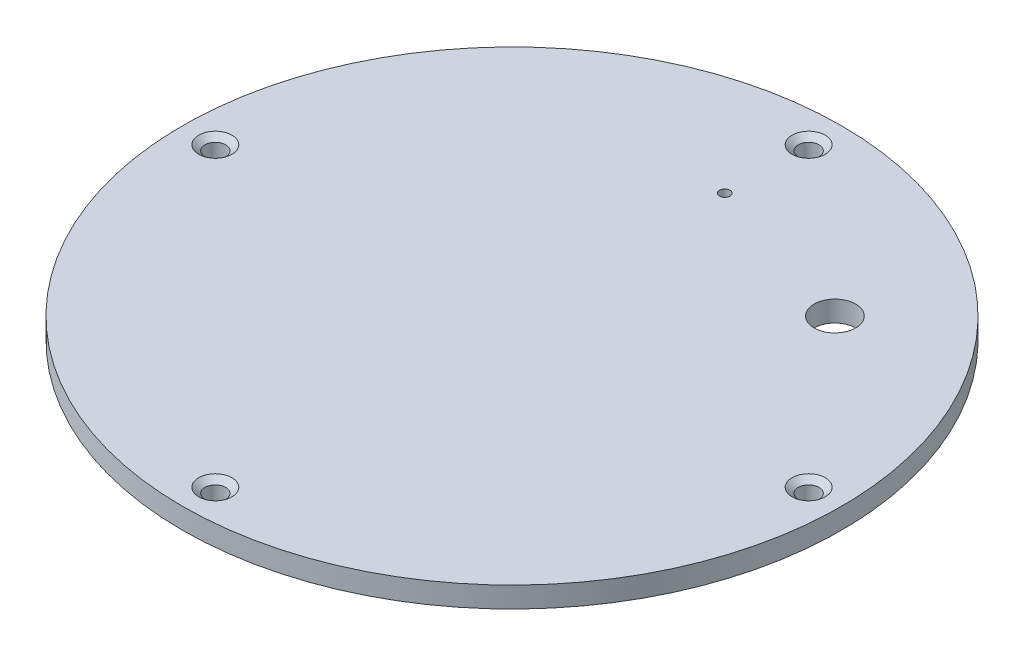
from build123d import *

# Parameters (mm, degrees)
SKETCH1_R                                       = 15.875
BOSS_EXTRUDE1_DEPTH                             = 1
CSK_FOR_M2_FLAT_HEAD_MACHINE_SCREW1_D           = 1
CSK_FOR_M2_FLAT_HEAD_MACHINE_SCREW1_CSINK_D     = 1.6
CSK_FOR_M2_FLAT_HEAD_MACHINE_SCREW1_CSINK_ANGLE = 100
CUT_EXTRUDE1_DEPTH                              = 23.472900347
CUT_EXTRUDE1_DEPTH_BACK                         = 23.472900347
SKETCH5_R                                       = 0.25
SKETCH5_R_2                                     = 1


with BuildPart() as part:
    # Sketch1 → Boss-Extrude1 (new body)
    with BuildSketch(Plane(origin=(0, 0, 0), x_dir=(1, 0, 0), z_dir=(0, 1, 0))):
        with Locations(Location((0, 0, 0), (0, 0, 270))):
            Circle(SKETCH1_R)
    extrude(amount=BOSS_EXTRUDE1_DEPTH)

    # CSK for M2 Flat Head Machine Screw1 (through all)
    with Locations(Plane(origin=(0, 1, 0), x_dir=(1, 0, 0), z_dir=(0, 1, 0))):
        with Locations((0, 14.29), (14.29, 0), (0, -14.29), (-14.29, 0)):
            CounterSinkHole(CSK_FOR_M2_FLAT_HEAD_MACHINE_SCREW1_D / 2, CSK_FOR_M2_FLAT_HEAD_MACHINE_SCREW1_CSINK_D / 2, counter_sink_angle=CSK_FOR_M2_FLAT_HEAD_MACHINE_SCREW1_CSINK_ANGLE)

    # Sketch5 → Cut-Extrude1 (cut, two sides: drawn at the far end of the back side and taken through both)
    with BuildSketch(Plane(origin=(0, 1, 0), x_dir=(1, 0, 0), z_dir=(0, 1, 0)).offset(-CUT_EXTRUDE1_DEPTH_BACK)):
        with Locations(Location((0, 10.25, 0), (0, 0, 270))):
            Circle(SKETCH5_R)
        with Locations(Location((7.778174593, 7.778174593, 0), (0, 0, 270))):
            Circle(SKETCH5_R_2)
    extrude(amount=CUT_EXTRUDE1_DEPTH + CUT_EXTRUDE1_DEPTH_BACK, mode=Mode.SUBTRACT)


solid = part.part
